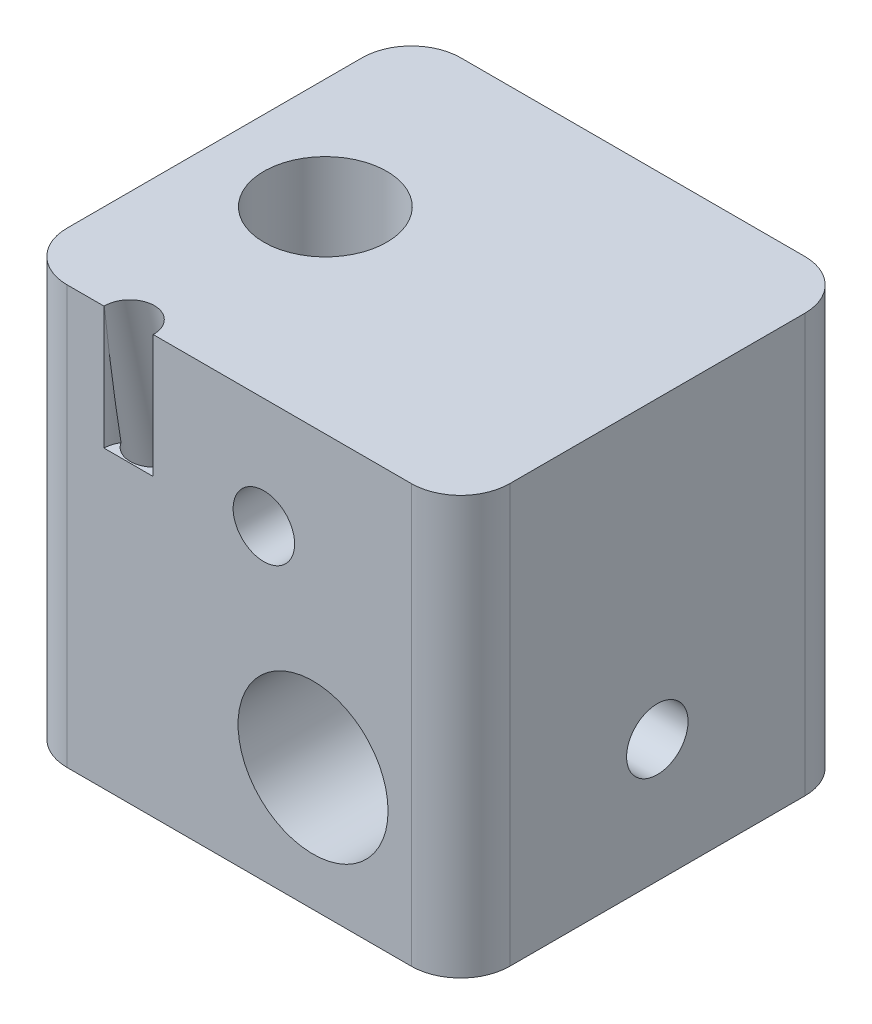
from build123d import *

# Parameters (mm, degrees)
BOSS_EXTRUDE1_DEPTH       = 17
SKETCH2_R                 = 3.05
CUT_EXTRUDE1_DEPTH        = 26.019992006
M3X0_5_TAPPED_HOLE1_D     = 2.5
M6X1_0_TAPPED_HOLE1_D     = 5
SKETCH7_R                 = 1
CUT_EXTRUDE2_DEPTH        = 5
M3X0_5_TAPPED_HOLE2_D     = 2.5
M3X0_5_TAPPED_HOLE2_DEPTH = 6
M3X0_5_TAPPED_HOLE2_TIP   = 0.751075774


with BuildPart() as part:
    # Sketch1 → Boss-Extrude1 (new body)
    with BuildSketch(Plane(origin=(0, 0, 0), x_dir=(1, 0, 0), z_dir=(0, 1, 0))):
        with BuildLine():
            Line((-7, 8), (7, 8))
            ThreePointArc((7, 8), (8.414213562, 7.414213562), (9, 6))
            Line((9, 6), (9, -6))
            ThreePointArc((9, -6), (8.414213562, -7.414213562), (7, -8))
            Line((7, -8), (-7, -8))
            ThreePointArc((-7, -8), (-8.414213562, -7.414213562), (-9, -6))
            Line((-9, -6), (-9, 6))
            ThreePointArc((-9, 6), (-8.414213562, 7.414213562), (-7, 8))
        make_face()
    extrude(amount=BOSS_EXTRUDE1_DEPTH)

    # Sketch2 → Cut-Extrude1 (cut, through all)
    with BuildSketch(Plane.XY.offset(8)):
        with Locations((3, 5)):
            Circle(SKETCH2_R)
    extrude(amount=-CUT_EXTRUDE1_DEPTH, mode=Mode.SUBTRACT)

    # M3x0.5 Tapped Hole1 (through all)
    with Locations(Plane.XY.offset(8)):
        with Locations((1, 12.5)):
            Hole(M3X0_5_TAPPED_HOLE1_D / 2)

    # M6x1.0 Tapped Hole1 (through all)
    with Locations(Plane(origin=(0, 17, 0), x_dir=(-1, 0, 0), z_dir=(0, 1, 0))):
        with Locations((4.5, 0)):
            Hole(M6X1_0_TAPPED_HOLE1_D / 2)

    # Sketch7 → Cut-Extrude2 (cut)
    with BuildSketch(Plane(origin=(0, 17, 0), x_dir=(1, 0, 0), z_dir=(0, 1, 0))):
        with Locations((-4.5, -8)):
            Circle(SKETCH7_R)
    extrude(amount=-CUT_EXTRUDE2_DEPTH, mode=Mode.SUBTRACT)

    # Sketch8 → Cut-Revolve1 (revolve, cut)
    with BuildSketch(Plane.ZY.offset(4.5), mode=Mode.PRIVATE) as cut_revolve1_sk:
        Polygon((4.796926452, 2.030181318), (5.9, 2.41), (9.273428811, 18.280734757), (8.29528121, 18.488646447), align=None)
    revolve(cut_revolve1_sk.sketch.rotate(Axis((-4.5, 1.132659385, 4.606152276), (0, 0.9781476007338057, 0.2079116908177597)), 180), axis=Axis((-4.5, 1.132659385, 4.606152276), (0, 0.9781476007338057, 0.2079116908177597)), mode=Mode.SUBTRACT)

    # M3x0.5 Tapped Hole2
    with Locations(Plane(origin=(9, 0, 0), x_dir=(0, 0, -1), z_dir=(1, 0, 0))):
        with Locations((0, 5)):
            Hole(M3X0_5_TAPPED_HOLE2_D / 2, depth=M3X0_5_TAPPED_HOLE2_DEPTH)
            with Locations((0, 0, -(M3X0_5_TAPPED_HOLE2_DEPTH + M3X0_5_TAPPED_HOLE2_TIP / 2))):  # 118° drill point
                Cone(0, M3X0_5_TAPPED_HOLE2_D / 2, M3X0_5_TAPPED_HOLE2_TIP, mode=Mode.SUBTRACT)


solid = part.part
